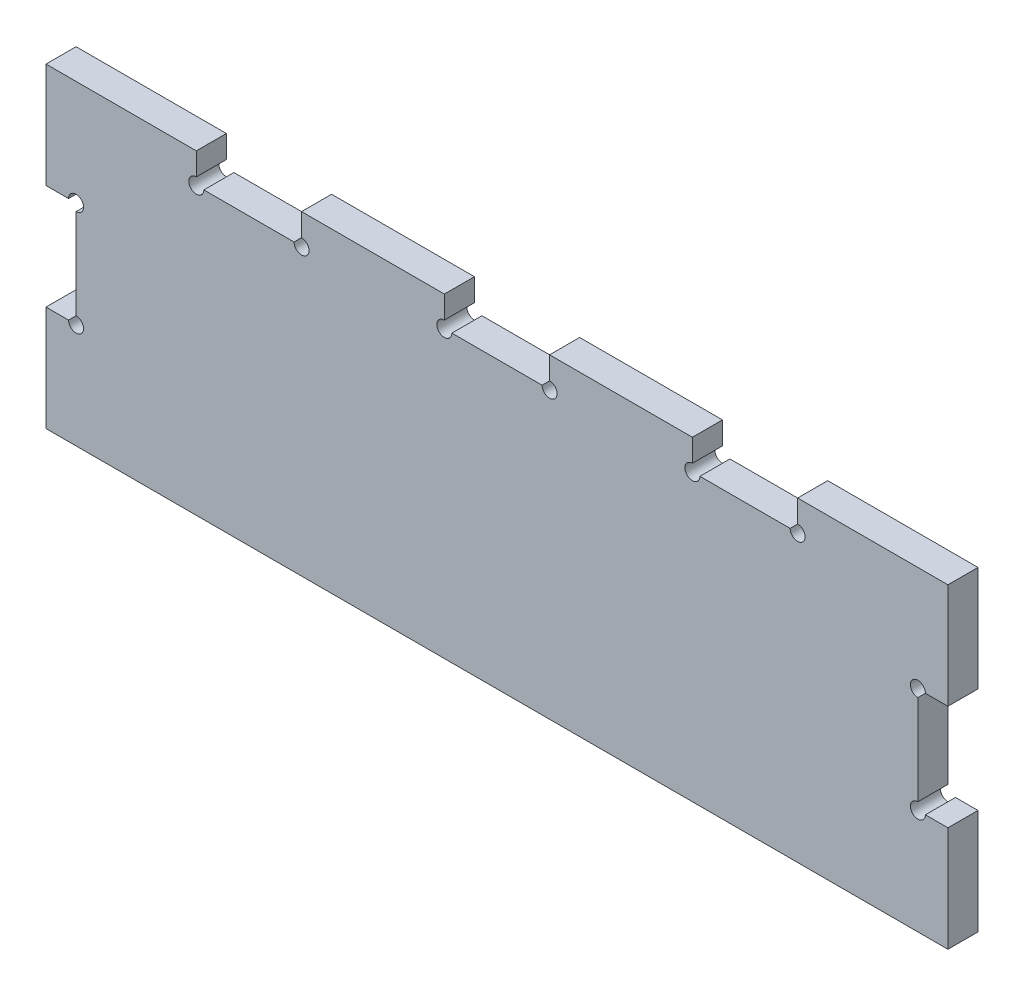
from build123d import *

# Parameters (mm, degrees)
SKETCH_1_W          = 60
SKETCH_1_H          = 21
EXTRUDE_1_DEPTH     = 2
SKETCH_2_W          = 2
SKETCH_2_H          = 7
CUT_EXTRUDE_1_DEPTH = 64.600314465
SKETCH_3_W          = 7
SKETCH_3_H          = 2
CUT_EXTRUDE_2_DEPTH = 64.600314465
SKETCH_5_R          = 0.5
CUT_EXTRUDE_3_DEPTH = 64.600314465


with BuildPart() as part:
    # 草图1 → 凸台-拉伸1 (new body)
    with BuildSketch(Plane.XY):
        with Locations((30, 10.5)):
            Rectangle(SKETCH_1_W, SKETCH_1_H)
    extrude(amount=EXTRUDE_1_DEPTH)

    # 草图2 → 切除-拉伸1 (cut, through all)
    with BuildSketch(Plane.XY.offset(2)):
        with Locations((1, 10.5)):
            Rectangle(SKETCH_2_W, SKETCH_2_H)
        with Locations((59, 10.5)):
            Rectangle(SKETCH_2_W, SKETCH_2_H)
    extrude(amount=-CUT_EXTRUDE_1_DEPTH, mode=Mode.SUBTRACT)

    # 草图3 → 切除-拉伸2 (cut, through all)
    with BuildSketch(Plane.XY.offset(2)):
        with Locations((13.5, 20)):
            Rectangle(SKETCH_3_W, SKETCH_3_H)
        with Locations((30, 20)):
            Rectangle(SKETCH_3_W, SKETCH_3_H)
        with Locations((46.5, 20)):
            Rectangle(SKETCH_3_W, SKETCH_3_H)
    extrude(amount=-CUT_EXTRUDE_2_DEPTH, mode=Mode.SUBTRACT)

    # 草图5 → 切除-拉伸3 (cut, through all)
    with BuildSketch(Plane.XY.offset(2)):
        with Locations((2, 7)):
            Circle(SKETCH_5_R)
    cut_extrude_3 = extrude(amount=-CUT_EXTRUDE_3_DEPTH, mode=Mode.SUBTRACT)

    # 草图阵列1: 切除-拉伸3 at 9 more places
    with Locations((0, 7, 0), (8, 12, 0), (15, 12, 0), (24.5, 12, 0), (31.5, 12, 0), (41, 12, 0), (48, 12, 0), (56, 7, 0), (56, 0, 0)):
        add(cut_extrude_3, mode=Mode.SUBTRACT)


solid = part.part
